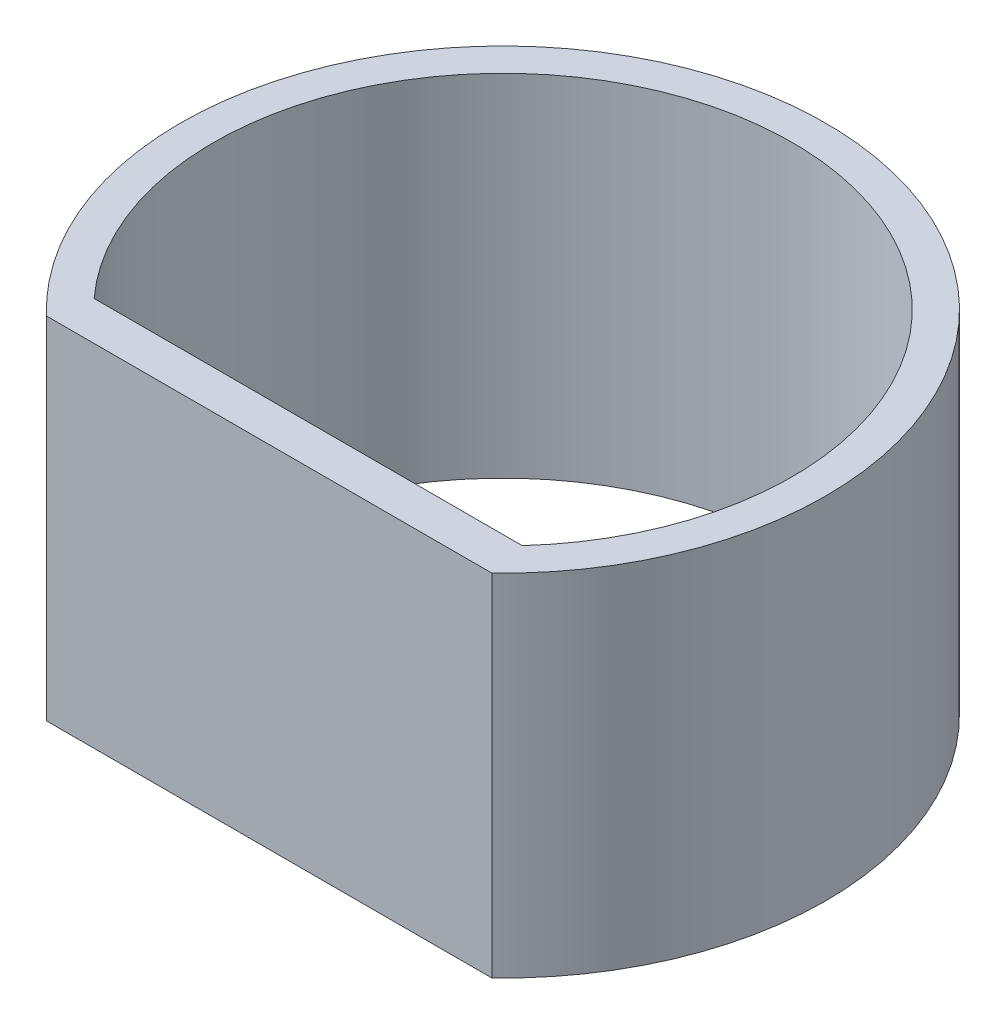
from build123d import *

# Parameters (mm, degrees)
BOSS_EXTRUDE1_DEPTH = 6.3


with BuildPart() as part:
    # Sketch2 → Boss-Extrude1 (new body)
    with BuildSketch(Plane(origin=(0, 0, 0), x_dir=(1, 0, 0), z_dir=(0, 1, 0))):
        with BuildLine():
            Line((4, -4.2), (-4, -4.2))
            ThreePointArc((-4, -4.2), (0, 5.8), (4, -4.2))
        make_face()
        with BuildLine():
            Line((-3.845776905, -3.5), (3.845776905, -3.5))
            ThreePointArc((3.845776905, -3.5), (0, 5.2), (-3.845776905, -3.5))
        make_face(mode=Mode.SUBTRACT)
    extrude(amount=BOSS_EXTRUDE1_DEPTH)


solid = part.part
